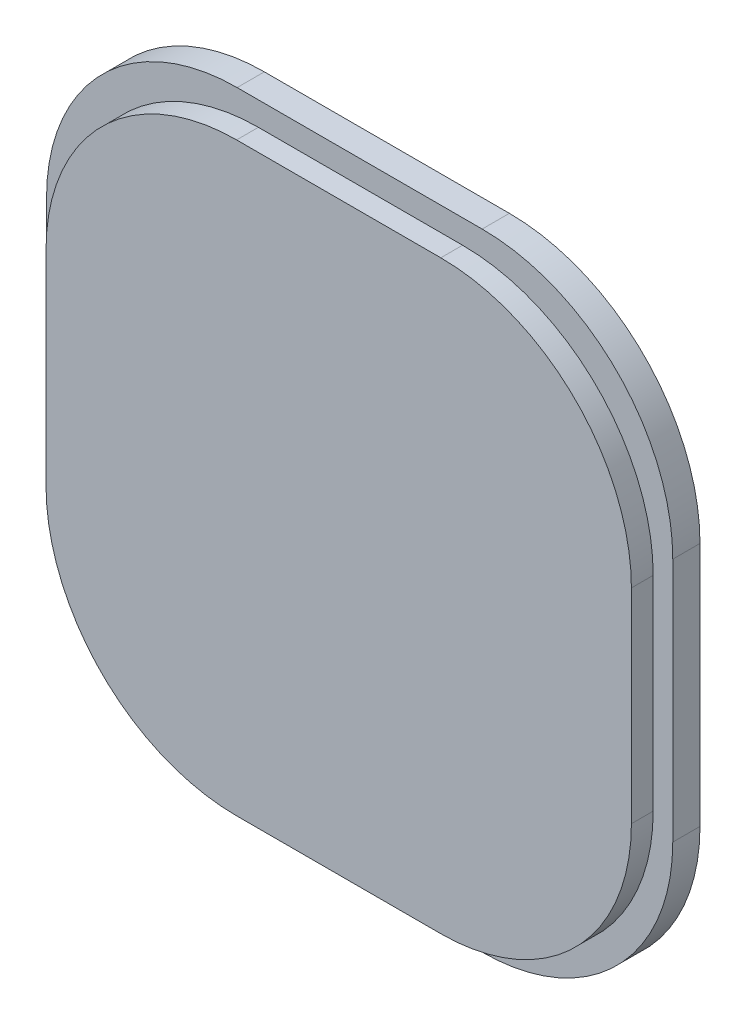
from build123d import *

# Parameters (mm, degrees)
EXTRUDE_2_DEPTH = 1
EXTRUDE_3_DEPTH = 0.8


with BuildPart() as part:
    # 草图1 → 凸台-拉伸2 (new body)
    with BuildSketch(Plane.XY):
        with BuildLine():
            Line((-48.671389481, 17.345225753), (-39.671389481, 17.345225753))
            ThreePointArc((-39.671389481, 17.345225753), (-34.721642013, 15.294973222), (-32.671389481, 10.345225753))
            Line((-32.671389481, 10.345225753), (-32.671389481, 1.345225753))
            ThreePointArc((-32.671389481, 1.345225753), (-34.721642013, -3.604521715), (-39.671389481, -5.654774247))
            Line((-39.671389481, -5.654774247), (-48.671389481, -5.654774247))
            ThreePointArc((-48.671389481, -5.654774247), (-53.621136949, -3.604521715), (-55.671389481, 1.345225753))
            Line((-55.671389481, 1.345225753), (-55.671389481, 10.345225753))
            ThreePointArc((-55.671389481, 10.345225753), (-53.621136949, 15.294973222), (-48.671389481, 17.345225753))
        make_face()
    extrude(amount=EXTRUDE_2_DEPTH)

    # 草图2 → 凸台-拉伸3 (add)
    with BuildSketch(Plane.XY.offset(1)):
        with BuildLine():
            Line((-47.890592888, 16.471105679), (-40.390592888, 16.471105679))
            ThreePointArc((-40.390592888, 16.471105679), (-35.44084542, 14.420853148), (-33.390592888, 9.471105679))
            Line((-33.390592888, 9.471105679), (-33.390592888, 1.971105679))
            ThreePointArc((-33.390592888, 1.971105679), (-35.44084542, -2.978641789), (-40.390592888, -5.028894321))
            Line((-40.390592888, -5.028894321), (-47.890592888, -5.028894321))
            ThreePointArc((-47.890592888, -5.028894321), (-52.840340356, -2.978641789), (-54.890592888, 1.971105679))
            Line((-54.890592888, 1.971105679), (-54.890592888, 9.471105679))
            ThreePointArc((-54.890592888, 9.471105679), (-52.840340356, 14.420853148), (-47.890592888, 16.471105679))
        make_face()
    extrude(amount=EXTRUDE_3_DEPTH)


solid = part.part
